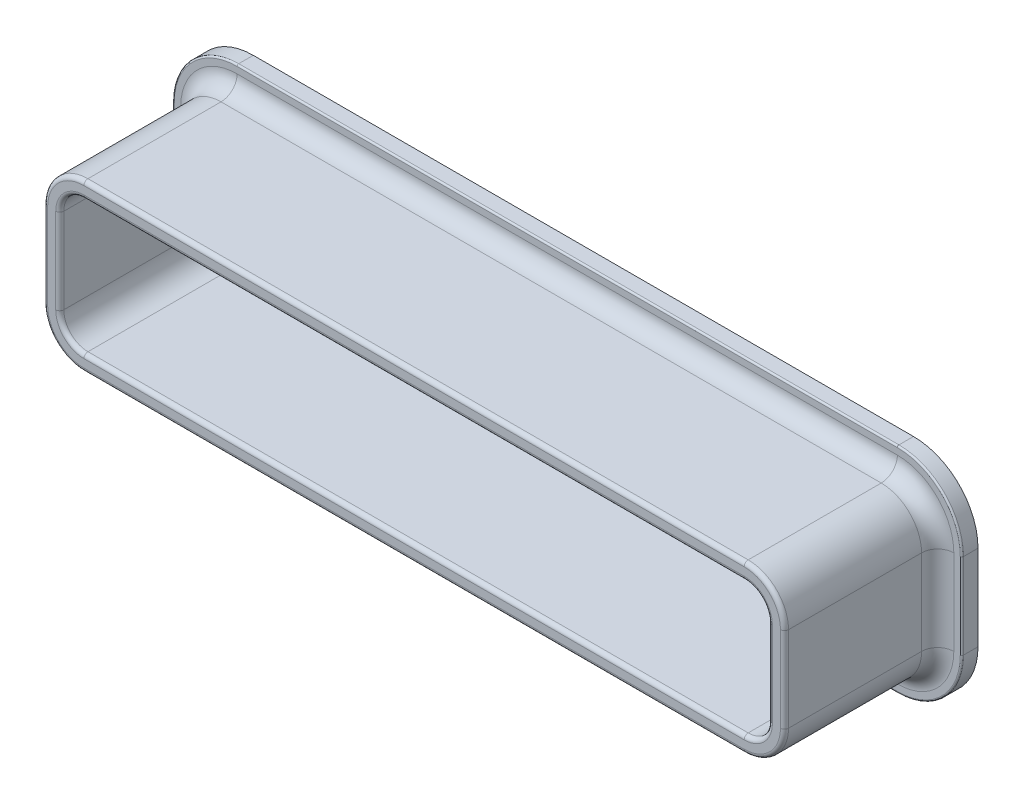
from build123d import *

# Parameters (mm, degrees)
BOSS_EXTRUDE1_DEPTH = 2
BOSS_EXTRUDE2_DEPTH = 19
CUT_EXTRUDE1_DEPTH  = 32
FILLET1_R           = 0.5
FILLET2_R           = 2
FILLET3_R           = 2
FILLET4_R           = 0.2


with BuildPart() as part:
    # Sketch1 → Boss-Extrude1 (new body)
    with BuildSketch(Plane.XY):
        with BuildLine():
            Line((80.75048871, 10.874070422), (-1.128427562, 10.874070422))
            ThreePointArc((-1.128427562, 10.874070422), (-6.785281811, 8.530924671), (-9.128427562, 2.874070422))
            Line((-9.128427562, 2.874070422), (-9.128427562, -7.709925539))
            ThreePointArc((-9.128427562, -7.709925539), (-6.785281811, -13.366779789), (-1.128427562, -15.709925539))
            Line((-1.128427562, -15.709925539), (80.75048871, -15.709925539))
            ThreePointArc((80.75048871, -15.709925539), (86.40734296, -13.366779789), (88.75048871, -7.709925539))
            Line((88.75048871, -7.709925539), (88.75048871, 2.874070422))
            ThreePointArc((88.75048871, 2.874070422), (86.40734296, 8.530924671), (80.75048871, 10.874070422))
        make_face()
    extrude(amount=-BOSS_EXTRUDE1_DEPTH)

    # Sketch1<6> → Boss-Extrude2 (add)
    with BuildSketch(Plane.XY):
        with BuildLine():
            Line((80.75048871, 7.874070422), (-1.128427562, 7.874070422))
            ThreePointArc((-1.128427562, 7.874070422), (-4.663961468, 6.409604328), (-6.128427562, 2.874070422))
            Line((-6.128427562, 2.874070422), (-6.128427562, -7.709925539))
            ThreePointArc((-6.128427562, -7.709925539), (-4.663961468, -11.245459445), (-1.128427562, -12.709925539))
            Line((-1.128427562, -12.709925539), (80.75048871, -12.709925539))
            ThreePointArc((80.75048871, -12.709925539), (84.286022616, -11.245459445), (85.75048871, -7.709925539))
            Line((85.75048871, -7.709925539), (85.75048871, 2.874070422))
            ThreePointArc((85.75048871, 2.874070422), (84.286022616, 6.409604328), (80.75048871, 7.874070422))
        make_face()
    extrude(amount=BOSS_EXTRUDE2_DEPTH)

    # Sketch2 → Cut-Extrude1 (cut)
    with BuildSketch(Plane.XY.offset(19)):
        with BuildLine():
            Line((-4.128427562, 2.874070422), (-4.128427562, -7.709925539))
            ThreePointArc((-4.128427562, -7.709925539), (-3.249747905, -9.831245883), (-1.128427562, -10.709925539))
            Line((-1.128427562, -10.709925539), (80.75048871, -10.709925539))
            ThreePointArc((80.75048871, -10.709925539), (82.871809054, -9.831245883), (83.75048871, -7.709925539))
            Line((83.75048871, -7.709925539), (83.75048871, 2.874070422))
            ThreePointArc((83.75048871, 2.874070422), (82.871809054, 4.995390765), (80.75048871, 5.874070422))
            Line((80.75048871, 5.874070422), (-1.128427562, 5.874070422))
            ThreePointArc((-1.128427562, 5.874070422), (-3.249747905, 4.995390765), (-4.128427562, 2.874070422))
        make_face()
    extrude(amount=-CUT_EXTRUDE1_DEPTH, mode=Mode.SUBTRACT)

    # Fillet1
    fillet1_edges = [part.edges().sort_by_distance(p)[0] for p in [
        (39.811030574, 7.874070422, 19),
        (84.286022616, 6.409604328, 19),
        (85.75048871, -2.417927559, 19),
        (84.286022616, -11.245459445, 19),
        (39.811030574, -12.709925539, 19),
        (-4.663961468, -11.245459445, 19),
        (-6.128427562, -2.417927559, 19),
        (-4.663961468, 6.409604328, 19),
        (-4.128427562, -2.417927559, 19),
        (-3.249747905, -9.831245883, 19),
        (39.811030574, -10.709925539, 19),
        (82.871809054, -9.831245883, 19),
        (83.75048871, -2.417927559, 19),
        (82.871809054, 4.995390765, 19),
        (39.811030574, 5.874070422, 19),
        (-3.249747905, 4.995390765, 19),
    ]]
    fillet(fillet1_edges, radius=FILLET1_R)

    # Fillet2
    fillet2_edges = [part.edges().sort_by_distance(p)[0] for p in [
        (-4.663961468, 6.409604328, 0),
        (-6.128427562, -2.417927559, 0),
        (-4.663961468, -11.245459445, 0),
        (39.811030574, -12.709925539, 0),
        (84.286022616, -11.245459445, 0),
        (85.75048871, -2.417927559, 0),
        (84.286022616, 6.409604328, 0),
        (39.811030574, 7.874070422, 0),
    ]]
    fillet(fillet2_edges, radius=FILLET2_R)

    # Fillet3
    fillet3_edges = [part.edges().sort_by_distance(p)[0] for p in [
        (-3.249747905, -9.831245883, -2),
        (-4.128427562, -2.417927559, -2),
        (-3.249747905, 4.995390765, -2),
        (39.811030574, 5.874070422, -2),
        (82.871809054, 4.995390765, -2),
        (83.75048871, -2.417927559, -2),
        (82.871809054, -9.831245883, -2),
        (39.811030574, -10.709925539, -2),
    ]]
    fillet(fillet3_edges, radius=FILLET3_R)

    # Fillet4
    fillet4_edges = [part.edges().sort_by_distance(p)[0] for p in [
        (-6.785281811, 8.530924671, 0),
        (-9.128427562, -2.417927559, 0),
        (-6.785281811, -13.366779789, 0),
        (39.811030574, -15.709925539, 0),
        (86.40734296, -13.366779789, 0),
        (88.75048871, -2.417927559, 0),
        (86.40734296, 8.530924671, 0),
        (39.811030574, 10.874070422, 0),
    ]]
    fillet(fillet4_edges, radius=FILLET4_R)


solid = part.part
